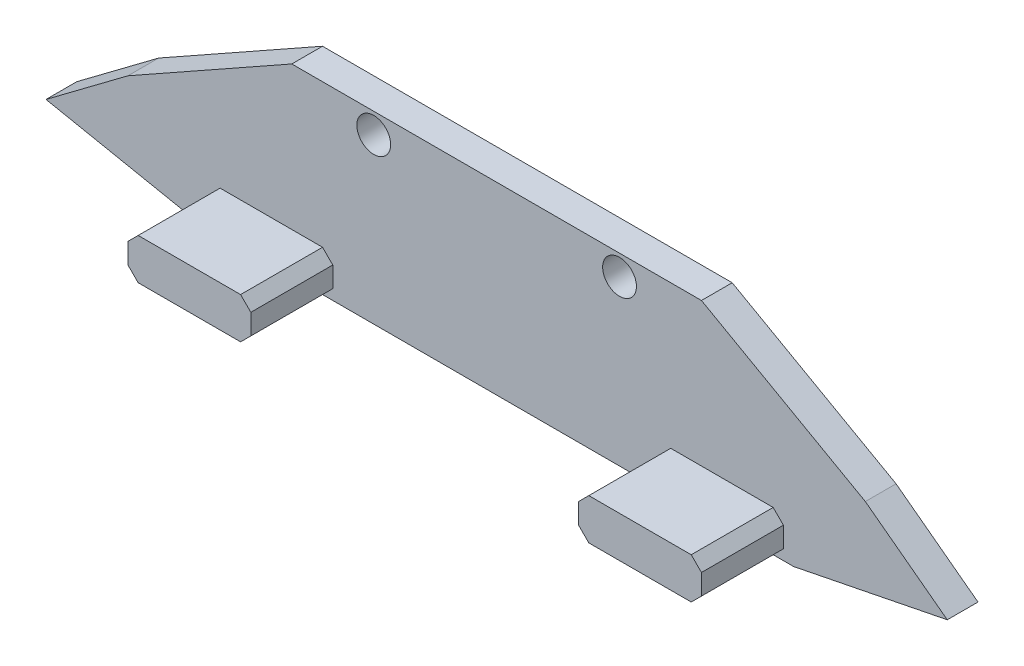
from build123d import *

# Parameters (mm, degrees)
SKETCH_1_R       = 1.65
F_3MM_DEPTH      = 3
F_32MM_1_START   = 3
F_32MM_1_DEPTH   = 8
F_32MM_1_2_DEPTH = 8


with BuildPart() as part:
    # 草图1 → 斜切鼻件底座_3mm (new body)
    with BuildSketch(Plane.XY):
        Polygon((-29, 73), (29, 73), (44, 76), (36, 82), (20, 91), (-20, 91), (-36, 82), (-44, 76), align=None)
        with Locations((-12, 89)):
            Circle(SKETCH_1_R, mode=Mode.SUBTRACT)
        with Locations((12, 89)):
            Circle(SKETCH_1_R, mode=Mode.SUBTRACT)
    extrude(amount=F_3MM_DEPTH)

    # 草图2 → 32mm__-1 (add)
    with BuildSketch(Plane.XY.offset(F_32MM_1_START)):
        Polygon((-27, 73), (-17, 73), (-16, 74), (-16, 76), (-17, 77), (-27, 77), (-28, 76), (-28, 74), align=None)
    extrude(amount=F_32MM_1_DEPTH)

    # 草图3 → 32mm__1 2 (add)
    with BuildSketch(Plane.XY.offset(F_32MM_1_START)):
        Polygon((17, 73), (27, 73), (28, 74), (28, 76), (27, 77), (17, 77), (16, 76), (16, 74), align=None)
    extrude(amount=F_32MM_1_2_DEPTH)


solid = part.part
